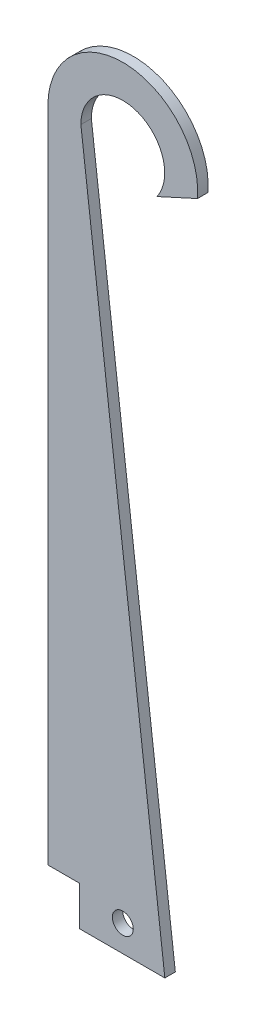
from build123d import *

# Parameters (mm, degrees)
SKETCH1_R           = 6.35
BOSS_EXTRUDE1_DEPTH = 6.35


with BuildPart() as part:
    # Sketch1 → Boss-Extrude1 (new body)
    with BuildSketch(Plane.XY):
        with BuildLine():
            Line((3.331127109, 389.92455355), (27.90992579, 401.162728042))
            ThreePointArc((27.90992579, 401.162728042), (-15.607198263, 450.028916488), (-62.759573024, 404.660447113))
            Line((-62.759573024, 404.660447113), (-62.759573024, 6.090179643))
            Line((-62.759573024, 6.090179643), (-43.715258354, 6.090179643))
            Line((-43.715258354, 6.090179643), (-43.715258354, -17.785820357))
            Line((-43.715258354, -17.785820357), (8.125653236, -17.785820357))
            Line((8.125653236, -17.785820357), (-42.757358599, 404.660447113))
            ThreePointArc((-42.757358599, 404.660447113), (-17.357358599, 430.060447113), (8.042641401, 404.660447113))
            ThreePointArc((8.042641401, 404.660447113), (6.83610681, 396.925058855), (3.331127109, 389.92455355))
        make_face()
        with Locations((-17.357358599, -1.739552887)):
            Circle(SKETCH1_R, mode=Mode.SUBTRACT)
    extrude(amount=BOSS_EXTRUDE1_DEPTH)


solid = part.part
